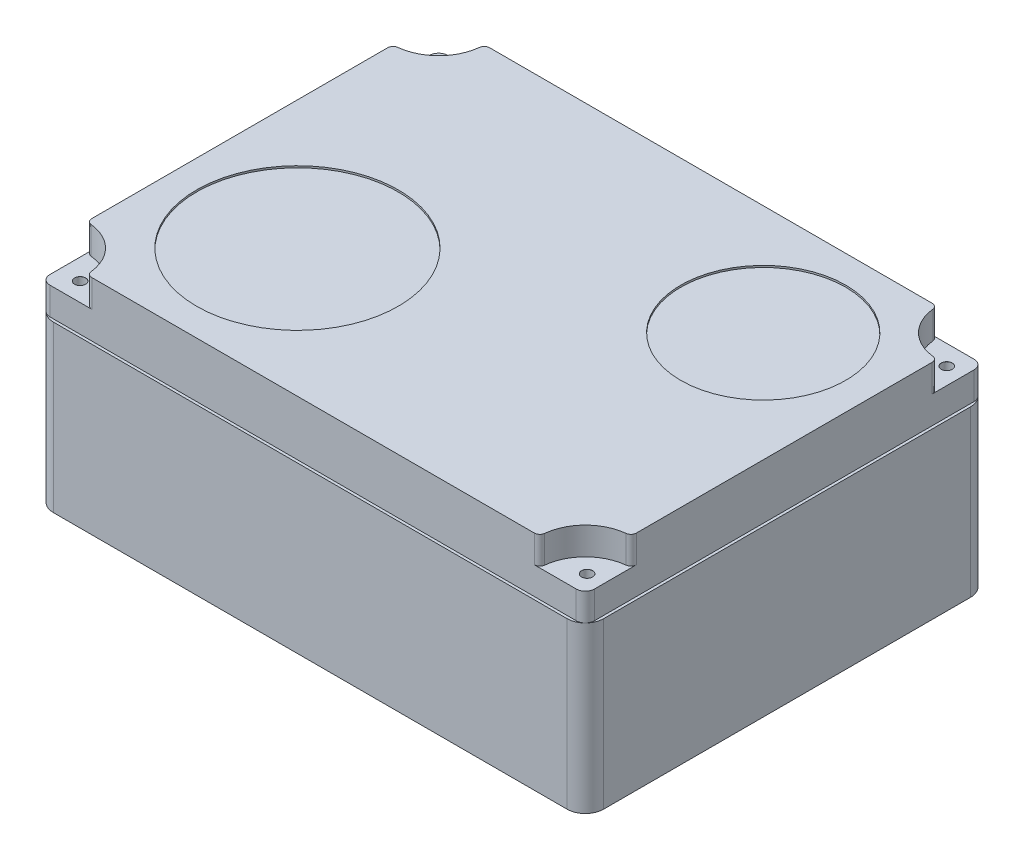
from build123d import *

# Parameters (mm, degrees)
SKETCH1_W                       = 300
SKETCH1_H                       = 220
BOSS_EXTRUDE1_DEPTH             = 120
SKETCH3_OUTSIDE_W               = 380.18
SKETCH3_OUTSIDE_H               = 300.18
SKETCH3_OUTSIDE_W_2             = 297
SKETCH3_OUTSIDE_H_2             = 217
CUT_EXTRUDE3_DEPTH              = 30
SKETCH4_R                       = 25
CUT_EXTRUDE4_DEPTH              = 15
FILLET1_R                       = 3
FILLET2_R                       = 5
FILLET3_R                       = 10
F_6_0MM_DOWEL_HOLE1_D           = 6
F_6_0MM_DOWEL_HOLE1_DEPTH       = 30
F_6_0MM_DOWEL_HOLE1_CSINK_D     = 6.05
F_6_0MM_DOWEL_HOLE1_CSINK_ANGLE = 90
F_6_0MM_DOWEL_HOLE1_TIP         = 1.802581857
SKETCH10_R                      = 55
SKETCH10_R_2                    = 45
CUT_EXTRUDE5_DEPTH              = 1
SKETCH11_R                      = 9
CUT_EXTRUDE6_DEPTH              = 30


with BuildPart() as part:
    # Sketch1 → Boss-Extrude1 (new body)
    with BuildSketch(Plane(origin=(0, 0, 0), x_dir=(1, 0, 0), z_dir=(0, 1, 0))):
        Rectangle(SKETCH1_W, SKETCH1_H)
    extrude(amount=BOSS_EXTRUDE1_DEPTH)

    # Sketch3 outside → Cut-Extrude3 (cut)
    with BuildSketch(Plane(origin=(0, 120, 0), x_dir=(1, 0, 0), z_dir=(0, 1, 0))):
        Rectangle(SKETCH3_OUTSIDE_W, SKETCH3_OUTSIDE_H)
        Rectangle(SKETCH3_OUTSIDE_W_2, SKETCH3_OUTSIDE_H_2, mode=Mode.SUBTRACT)
    extrude(amount=-CUT_EXTRUDE3_DEPTH, mode=Mode.SUBTRACT)

    # Sketch4 → Cut-Extrude4 (cut)
    with BuildSketch(Plane(origin=(0, 120, 0), x_dir=(1, 0, 0), z_dir=(0, 1, 0))):
        with Locations((-148.5, -108.5)):
            Circle(SKETCH4_R)
        with Locations((-148.5, 108.5)):
            Circle(SKETCH4_R)
        with Locations((148.5, 108.5)):
            Circle(SKETCH4_R)
        with Locations((148.5, -108.5)):
            Circle(SKETCH4_R)
    extrude(amount=-CUT_EXTRUDE4_DEPTH, mode=Mode.SUBTRACT)

    # Fillet1
    fillet1_edges = [part.edges().sort_by_distance(p)[0] for p in [
        (148.5, 112.5, 83.5),
        (123.5, 112.5, 108.5),
        (123.5, 112.5, -108.5),
        (148.5, 112.5, -83.5),
        (-123.5, 112.5, -108.5),
        (-148.5, 112.5, -83.5),
        (-123.5, 112.5, 108.5),
        (-148.5, 112.5, 83.5),
    ]]
    fillet(fillet1_edges, radius=FILLET1_R)

    # Fillet2
    fillet2_edges = [part.edges().sort_by_distance(p)[0] for p in [
        (148.5, 97.5, -108.5),
        (148.5, 97.5, 108.5),
        (-148.5, 97.5, 108.5),
        (-148.5, 97.5, -108.5),
    ]]
    fillet(fillet2_edges, radius=FILLET2_R)

    # Fillet3
    fillet3_edges = [part.edges().sort_by_distance(p)[0] for p in [
        (-150, 45, -110),
        (150, 45, -110),
        (150, 45, 110),
        (-150, 45, 110),
    ]]
    fillet(fillet3_edges, radius=FILLET3_R)

    # Ø6.0mm Dowel Hole1
    with Locations(Plane(origin=(0, 105, 0), x_dir=(1, 0, 0), z_dir=(0, 1, 0))):
        with Locations((-137.151874048, 97.743982636), (-137.151874048, -98.364579351), (139.323962551, -98.364579351), (139.323962551, 97.743982636)):
            CounterSinkHole(F_6_0MM_DOWEL_HOLE1_D / 2, F_6_0MM_DOWEL_HOLE1_CSINK_D / 2, depth=F_6_0MM_DOWEL_HOLE1_DEPTH, counter_sink_angle=F_6_0MM_DOWEL_HOLE1_CSINK_ANGLE)
            with Locations((0, 0, -(F_6_0MM_DOWEL_HOLE1_DEPTH + F_6_0MM_DOWEL_HOLE1_TIP / 2))):  # 118° drill point
                Cone(0, F_6_0MM_DOWEL_HOLE1_D / 2, F_6_0MM_DOWEL_HOLE1_TIP, mode=Mode.SUBTRACT)

    # Sketch10 → Cut-Extrude5 (cut)
    with BuildSketch(Plane(origin=(0, 120, 0), x_dir=(1, 0, 0), z_dir=(0, 1, 0))):
        with Locations(Location((-78.5, -38.5, 0), (0, 0, 270))):
            Circle(SKETCH10_R)
        with Locations(Location((88.5, 48.5, 0), (0, 0, 270))):
            Circle(SKETCH10_R_2)
    extrude(amount=-CUT_EXTRUDE5_DEPTH, mode=Mode.SUBTRACT)

    # Sketch11 → Cut-Extrude6 (cut)
    with BuildSketch(Plane.XZ):
        with Locations(Location((120, 0, 0), (0, 0, 270))):
            Circle(SKETCH11_R)
        with Locations(Location((60, 0, 0), (0, 0, 270))):
            Circle(SKETCH11_R)
        with Locations(Location((-125, -75, 0), (0, 0, 270))):
            Circle(SKETCH11_R)
    extrude(amount=-CUT_EXTRUDE6_DEPTH, mode=Mode.SUBTRACT)


solid = part.part
